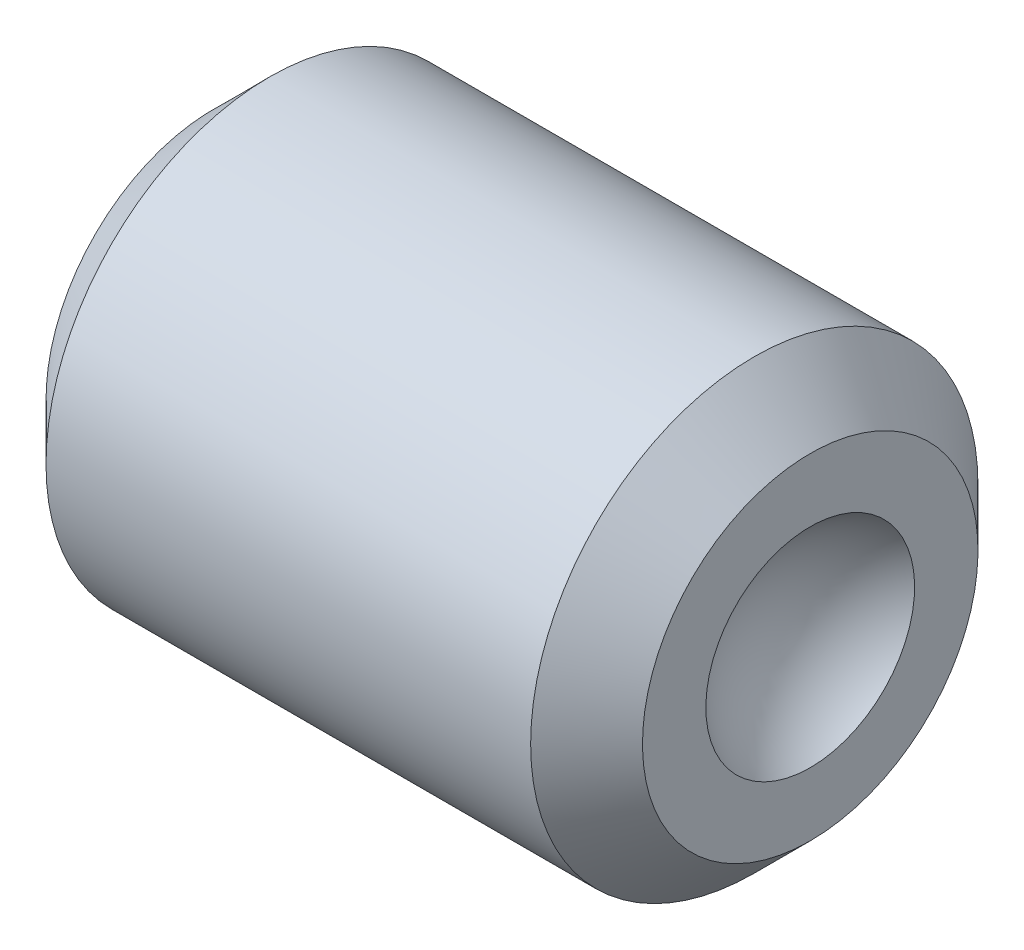
from build123d import *

# Parameters (mm, degrees)
CUT_EXTRUDE1_DEPTH = 2


with BuildPart() as part:
    # Sketch1 → Revolve1 (revolve)
    with BuildSketch(Plane.XY, mode=Mode.PRIVATE) as revolve1_sk:
        with BuildLine():
            Line((0, 0), (0, 1.125))
            Line((0, 1.125), (0.375, 1.5))
            Line((0.375, 1.5), (3.625, 1.5))
            Line((3.625, 1.5), (4, 1.125))
            Line((4, 1.125), (4, 0.7))
            ThreePointArc((4, 0.7), (3.724655592, 0.397059504), (3.625, 0))
            Line((3.625, 0), (0, 0))
        make_face()
    revolve(revolve1_sk.sketch.rotate(Axis((0, 0, 0), (1, 0, 0)), 180), axis=Axis((0, 0, 0), (1, 0, 0)))

    # Sketch2 → Cut-Extrude1 (cut)
    with BuildSketch(Plane.ZY):
        Polygon((0, 0.866025404), (-0.75, 0.433012702), (-0.75, -0.433012702), (0, -0.866025404), (0.75, -0.433012702), (0.75, 0.433012702), align=None)
    extrude(amount=-CUT_EXTRUDE1_DEPTH, mode=Mode.SUBTRACT)


solid = part.part
